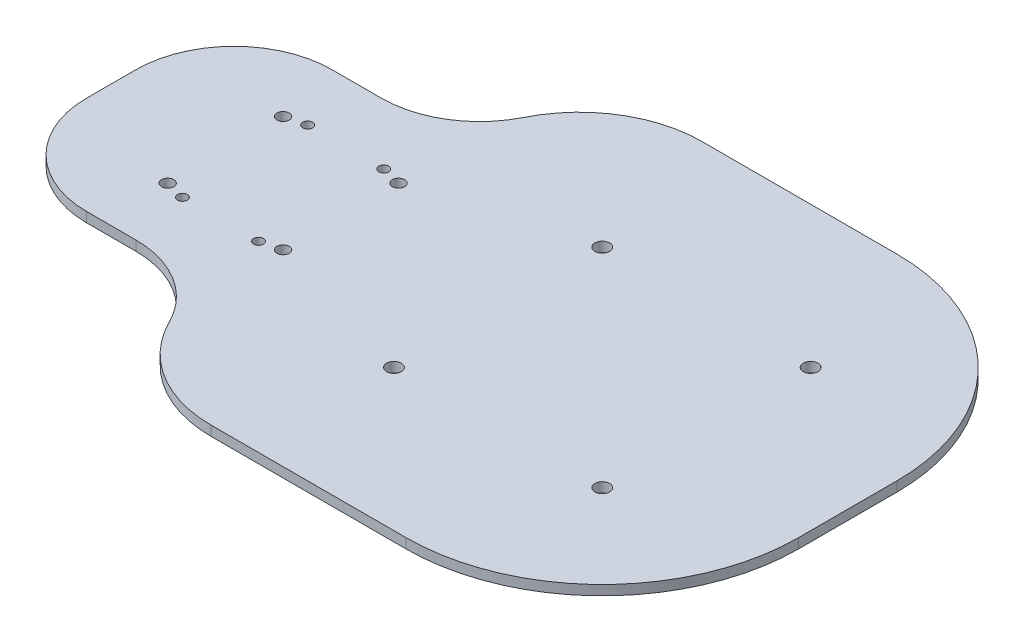
from build123d import *

# Parameters (mm, degrees)
BOSS_EXTRUDE1_DEPTH = 4
FILLET1_R           = 40
SKETCH2_R           = 3
CUT_EXTRUDE1_DEPTH  = 4
SKETCH3_R           = 2
SKETCH3_R_2         = 2.5
CUT_EXTRUDE2_DEPTH  = 4
FILLET2_R           = 80
FILLET3_R           = 50


with BuildPart() as part:
    # Sketch1 → Boss-Extrude1 (new body)
    with BuildSketch(Plane(origin=(0, 0, 0), x_dir=(1, 0, 0), z_dir=(0, 1, 0))):
        Polygon((-100, 100), (100, 100), (100, -100), (-100, -100), (-100, -50), (-200, -50), (-200, 50), (-100, 50), align=None)
    extrude(amount=BOSS_EXTRUDE1_DEPTH)

    # Fillet1
    fillet1_edges = [part.edges().sort_by_distance(p)[0] for p in [
        (-100, 2, 50),
        (-200, 2, 50),
        (-200, 2, -50),
        (-100, 2, -50),
    ]]
    fillet(fillet1_edges, radius=FILLET1_R)

    # Sketch2 → Cut-Extrude1 (cut)
    with BuildSketch(Plane(origin=(0, 4, 0), x_dir=(1, 0, 0), z_dir=(0, 1, 0))):
        with Locations(Location((42.425, 42.425, 0), (0, 0, 270))):
            Circle(SKETCH2_R)
        with Locations(Location((42.425, -42.425, 0), (0, 0, 270))):
            Circle(SKETCH2_R)
        with Locations(Location((-42.425, -42.425, 0), (0, 0, 270))):
            Circle(SKETCH2_R)
        with Locations(Location((-42.425, 42.425, 0), (0, 0, 270))):
            Circle(SKETCH2_R)
    extrude(amount=-CUT_EXTRUDE1_DEPTH, mode=Mode.SUBTRACT)

    # Sketch3 → Cut-Extrude2 (cut)
    with BuildSketch(Plane(origin=(0, 4, 0), x_dir=(1, 0, 0), z_dir=(0, 1, 0))):
        with Locations(Location((-114.5, -25.5, 0), (0, 0, 270))):
            Circle(SKETCH3_R)
        with Locations(Location((-106.5, 23.5, 0), (0, 0, 270))):
            Circle(SKETCH3_R_2)
        with Locations(Location((-153.5, 23.5, 0), (0, 0, 270))):
            Circle(SKETCH3_R_2)
        with Locations(Location((-153.5, -23.5, 0), (0, 0, 270))):
            Circle(SKETCH3_R_2)
        with Locations(Location((-106.5, -23.5, 0), (0, 0, 270))):
            Circle(SKETCH3_R_2)
        with Locations(Location((-145.5, -25.5, 0), (0, 0, 270))):
            Circle(SKETCH3_R)
        with Locations(Location((-145.5, 25.5, 0), (0, 0, 270))):
            Circle(SKETCH3_R)
        with Locations(Location((-114.5, 25.5, 0), (0, 0, 270))):
            Circle(SKETCH3_R)
    extrude(amount=-CUT_EXTRUDE2_DEPTH, mode=Mode.SUBTRACT)

    # Fillet2
    fillet2_edges = [part.edges().sort_by_distance(p)[0] for p in [
        (100, 2, 100),
        (100, 2, -100),
    ]]
    fillet(fillet2_edges, radius=FILLET2_R)

    # Fillet3
    fillet3_edges = [part.edges().sort_by_distance(p)[0] for p in [
        (-100, 2, -100),
        (-100, 2, 100),
    ]]
    fillet(fillet3_edges, radius=FILLET3_R)


solid = part.part
